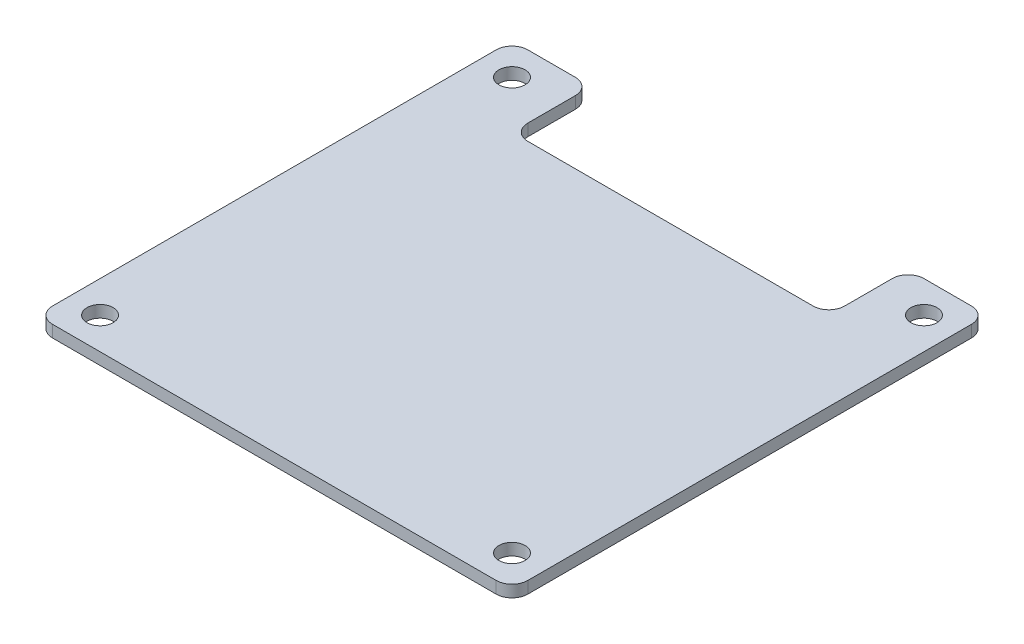
from build123d import *

# Parameters (mm, degrees)
SKETCH_1_R      = 1.65
EXTRUDE_1_DEPTH = 1.5
FILLET_1_R      = 2
FILLET_2_R      = 2


with BuildPart() as part:
    # Эскиз1 → Бобышка-Вытянуть1 (new body)
    with BuildSketch(Plane(origin=(0, 0, 0), x_dir=(1, 0, 0), z_dir=(0, 1, 0))):
        with BuildLine():
            Line((20, 30), (30, 30))
            Line((30, 30), (30, -30))
            Line((30, -30), (-30, -30))
            Line((-30, -30), (-30, 30))
            Line((-30, 30), (-20, 30))
            Line((-20, 30), (-20, 22))
            ThreePointArc((-20, 22), (-19.414213562, 20.585786438), (-18, 20))
            Line((-18, 20), (18, 20))
            ThreePointArc((18, 20), (19.414213562, 20.585786438), (20, 22))
            Line((20, 22), (20, 30))
        make_face()
        with Locations(Location((-26, 26, 0), (0, 0, 270))):
            Circle(SKETCH_1_R, mode=Mode.SUBTRACT)
        with Locations(Location((26, 26, 0), (0, 0, 270))):
            Circle(SKETCH_1_R, mode=Mode.SUBTRACT)
        with Locations(Location((-26, -26, 0), (0, 0, 270))):
            Circle(SKETCH_1_R, mode=Mode.SUBTRACT)
        with Locations(Location((26, -26, 0), (0, 0, 270))):
            Circle(SKETCH_1_R, mode=Mode.SUBTRACT)
    extrude(amount=EXTRUDE_1_DEPTH)

    # Скругление1
    fillet_1_edges = [part.edges().sort_by_distance(p)[0] for p in [
        (-30, 0.75, 30),
    ]]
    fillet(fillet_1_edges, radius=FILLET_1_R)

    # Скругление2
    fillet_2_edges = [part.edges().sort_by_distance(p)[0] for p in [
        (-30, 0.75, -30),
        (-20, 0.75, -30),
        (20, 0.75, -30),
        (30, 0.75, -30),
        (30, 0.75, 30),
    ]]
    fillet(fillet_2_edges, radius=FILLET_2_R)


solid = part.part
